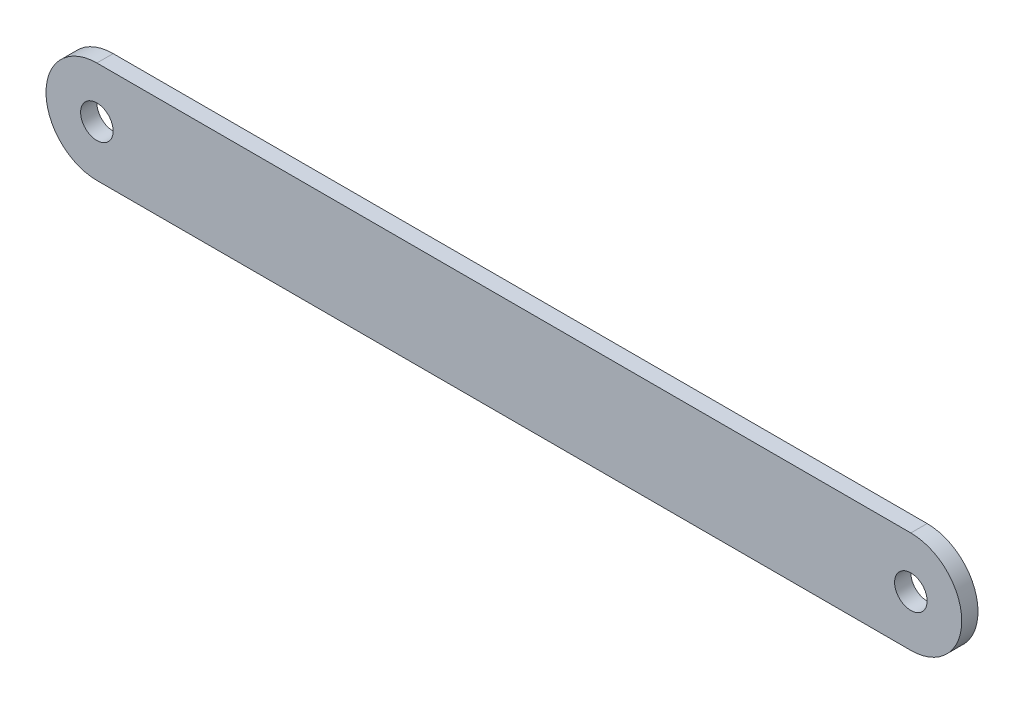
from build123d import *

# Parameters (mm, degrees)
SKETCH1_R           = 4
BOSS_EXTRUDE1_DEPTH = 4


with BuildPart() as part:
    # Sketch1 → Boss-Extrude1 (new body)
    with BuildSketch(Plane.XY):
        with BuildLine():
            Line((-41.004243227, 12.5), (158.995756773, 12.5))
            ThreePointArc((158.995756773, 12.5), (171.495756773, 0), (158.995756773, -12.5))
            Line((158.995756773, -12.5), (-41.004243227, -12.5))
            ThreePointArc((-41.004243227, -12.5), (-53.504243227, 0), (-41.004243227, 12.5))
        make_face()
        with Locations((-41.004243227, 0)):
            Circle(SKETCH1_R, mode=Mode.SUBTRACT)
        with Locations((158.995756773, 0)):
            Circle(SKETCH1_R, mode=Mode.SUBTRACT)
    extrude(amount=BOSS_EXTRUDE1_DEPTH)


solid = part.part
